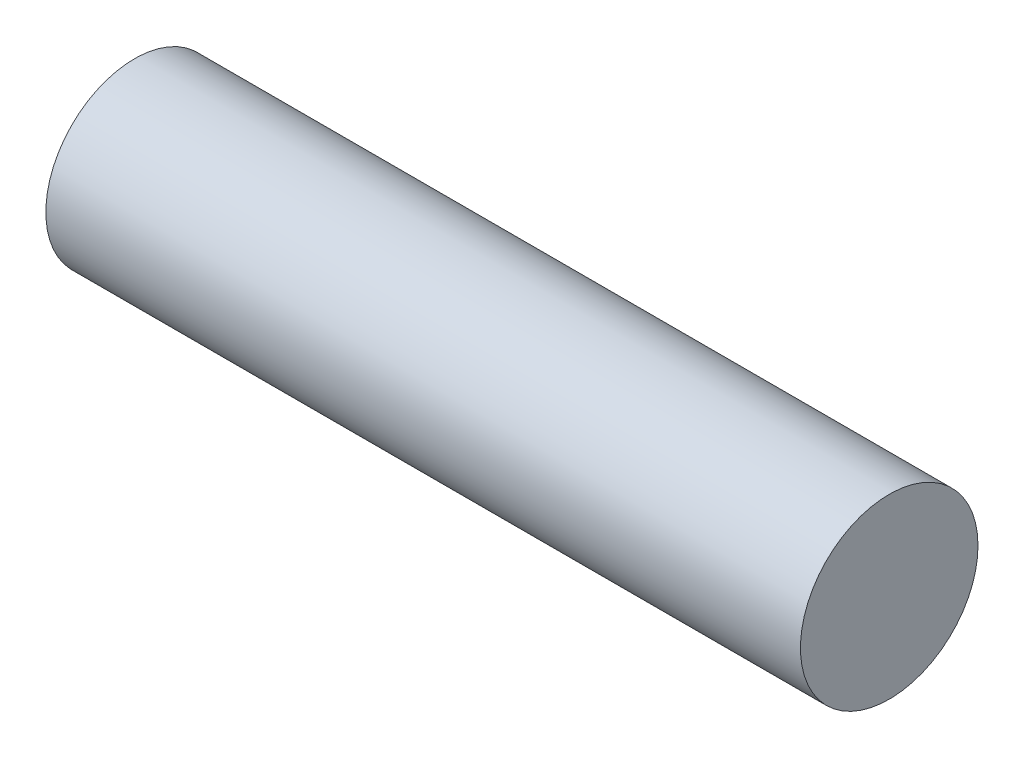
from build123d import *

# Parameters (mm, degrees)
SKETCH1_R           = 2
BOSS_EXTRUDE1_DEPTH = 17


with BuildPart() as part:
    # Sketch1 → Boss-Extrude1 (new body)
    with BuildSketch(Plane(origin=(0, 0, 0), x_dir=(0, 0, -1), z_dir=(1, 0, 0))):
        Circle(SKETCH1_R)
    extrude(amount=BOSS_EXTRUDE1_DEPTH)


solid = part.part
